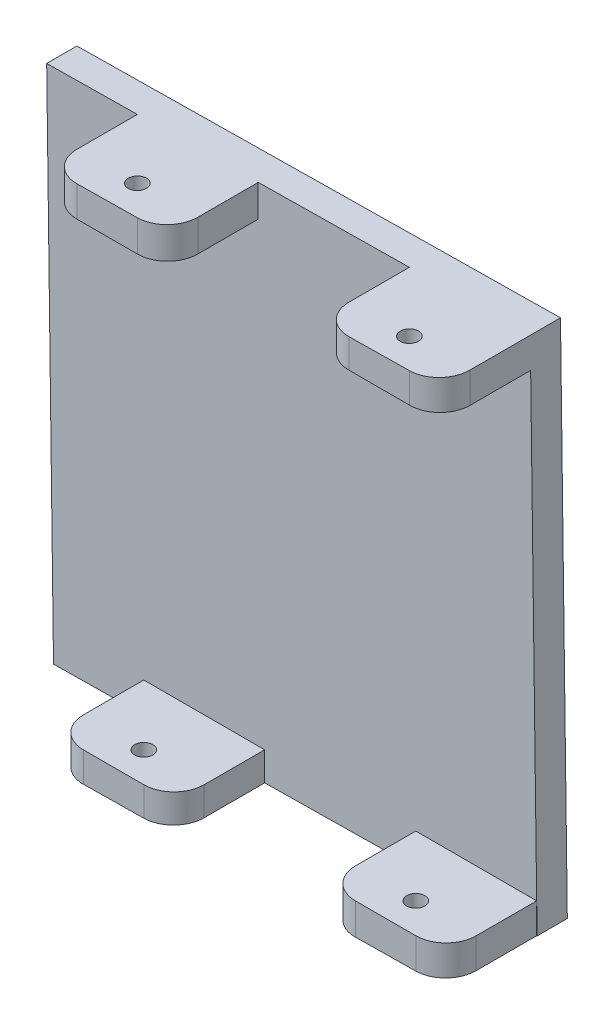
from build123d import *

# Parameters (mm, degrees)
BOSS_EXTRUDE1_DEPTH      = 5
BOSS_EXTRUDE2_DEPTH      = 20
FILLET1_R                = 5
F_3_0_3_DIAMETER_HOLE1_D = 3


with BuildPart() as part:
    # Sketch1 → Boss-Extrude1 (new body)
    with BuildSketch(Plane.XY):
        Polygon((-47.026906911, 0), (32.973093089, 1.057571587), (31.842813456, 86.557571587), (-48.157186544, 85.5), align=None)
    extrude(amount=BOSS_EXTRUDE1_DEPTH)

    # Sketch2 → Boss-Extrude2 (add)
    with BuildSketch(Plane.XY):
        Polygon((-33.157186544, 85.698294672), (-33.157186544, 80.698294672), (-13.157186544, 80.698294672), (-13.157186544, 85.962687569), align=None)
        Polygon((11.842813456, 86.29317869), (11.842813456, 81.558008427), (31.908905905, 81.558008427), (31.842813456, 86.557571587), align=None)
        Polygon((-32.092993586, 0.19742103), (-32.092993586, 5.19742103), (-12.092993586, 5.19742103), (-12.092993586, 0.461813927), align=None)
        Polygon((12.907006414, 0.792305048), (12.907006414, 6.056697944), (32.907006414, 6.056697944), (32.907006414, 1.056697944), align=None)
    extrude(amount=BOSS_EXTRUDE2_DEPTH)

    # Fillet1
    fillet1_edges = [part.edges().sort_by_distance(p)[0] for p in [
        (-33.157186544, 83.198294672, 20),
        (-13.157186544, 83.330491121, 20),
        (31.87585968, 84.057790007, 20),
        (11.842813456, 83.925593558, 20),
        (-12.092993586, 2.829617478, 20),
        (-32.092993586, 2.69742103, 20),
        (32.907006414, 3.556697944, 20),
        (12.907006414, 3.424501496, 20),
    ]]
    fillet(fillet1_edges, radius=FILLET1_R)

    # Ø3.0 (3) Diameter Hole1 (through all)
    with Locations(Plane(origin=(-1.138496573, 86.121570382, 0), x_dir=(0.9999126319463549, 0.013218489857519894, 0), z_dir=(-0.013218489857519894, 0.9999126319463549, 0))):
        with Locations((-22.021487627, -15), (22.982444279, -15)):
            Hole(F_3_0_3_DIAMETER_HOLE1_D / 2)


solid = part.part
